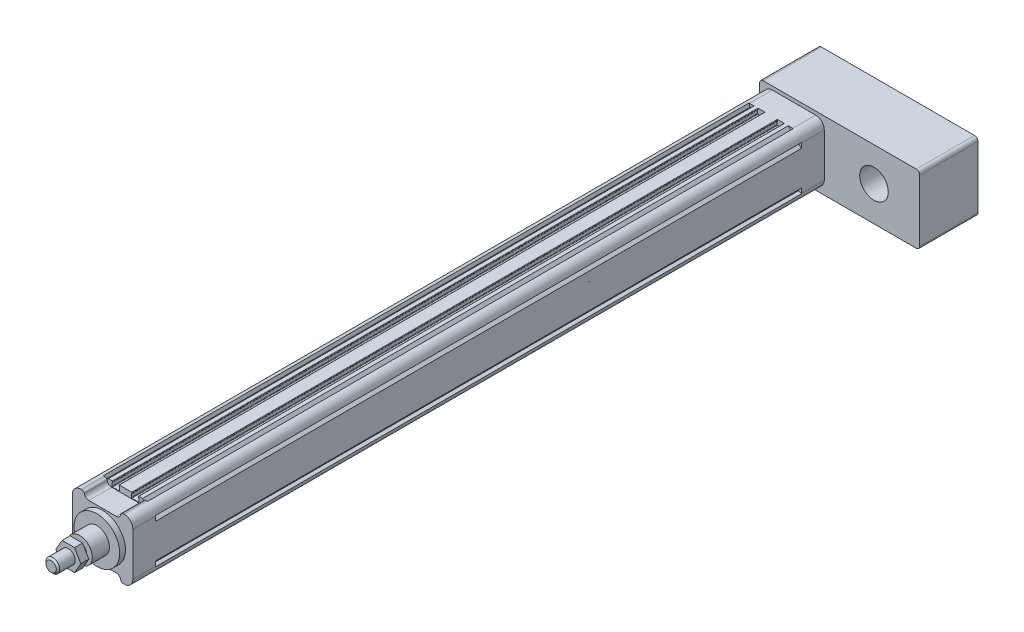
from build123d import *

# Parameters (mm, degrees)
SKETCH_1_R                  = 2.1
EXTRUDE_1_DEPTH             = 565
EXTRUDE_2_DEPTH             = 20
SKETCH_7_R                  = 20
EXTRUDE_3_DEPTH             = 5
SKETCH_9_R                  = 11
EXTRUDE_4_DEPTH             = 15
SKETCH_10_R                 = 6
EXTRUDE_5_DEPTH             = 25
EXTRUDE_START               = 20
EXTRUDE_6_DEPTH             = 20
EXTRUDE_7_DEPTH             = 51
SKETCH_13_R                 = 12.5
CUT_EXTRUDE_2_DEPTH         = 30
PATTERN_LINEAR_1_COUNT      = 2
PATTERN_LINEAR_1_PITCH      = 38
PATTERN_LINEAR_1_COUNT_DIR2 = 2
PATTERN_LINEAR_1_PITCH_DIR2 = 38
HOLE_WIZARD_M6_2_D          = 5
HOLE_WIZARD_M6_2_DEPTH      = 15
HOLE_WIZARD_M6_2_TIP        = 1.502151548
HOLE_WIZARD_M6_3_D          = 5
HOLE_WIZARD_M6_3_DEPTH      = 15
HOLE_WIZARD_M6_3_TIP        = 1.502151548
HOLE_WIZARD_M6_4_D          = 5
HOLE_WIZARD_M6_4_DEPTH      = 15
HOLE_WIZARD_M6_4_TIP        = 1.502151548
CHAMFER_1_SIZE              = 1.5
EXTRUDE_START_2             = 3
EXTRUDE_8_DEPTH             = 7


with BuildPart() as part:
    # 草图1 → 凸台-拉伸1 (new body)
    with BuildSketch(Plane.XY):
        with BuildLine():
            Line((-18.2, 24), (-19.443439638, 26.486879276))
            ThreePointArc((-19.443439638, 26.486879276), (-24.303300859, 24.303300859), (-26.486879276, 19.443439638))
            Line((-26.486879276, 19.443439638), (-24, 18.2))
            Line((-24, 18.2), (-24, 17.1))
            Line((-24, 17.1), (-26.5, 15))
            Line((-26.5, 15), (-26.5, -15))
            Line((-26.5, -15), (-24, -17.1))
            Line((-24, -17.1), (-24, -18.2))
            Line((-24, -18.2), (-26.486879276, -19.443439638))
            ThreePointArc((-26.486879276, -19.443439638), (-24.303300859, -24.303300859), (-19.443439638, -26.486879276))
            Line((-19.443439638, -26.486879276), (-18.2, -24))
            Line((-18.2, -24), (-17.1, -24))
            Line((-17.1, -24), (-15, -26.5))
            Line((-15, -26.5), (-11.65, -26.5))
            ThreePointArc((-11.65, -26.5), (-11.367157288, -26.382842712), (-11.25, -26.1))
            Line((-11.25, -26.1), (-11.25, -25.6))
            ThreePointArc((-11.25, -25.6), (-11.367157288, -25.317157288), (-11.65, -25.2))
            Line((-11.65, -25.2), (-11.75, -25.2))
            Line((-11.75, -25.2), (-11.75, -22.4))
            ThreePointArc((-11.75, -22.4), (-11.632842712, -22.117157288), (-11.35, -22))
            Line((-11.35, -22), (-5.65, -22))
            ThreePointArc((-5.65, -22), (-5.367157288, -22.117157288), (-5.25, -22.4))
            Line((-5.25, -22.4), (-5.25, -25.2))
            Line((-5.25, -25.2), (-5.35, -25.2))
            ThreePointArc((-5.35, -25.2), (-5.632842712, -25.317157288), (-5.75, -25.6))
            Line((-5.75, -25.6), (-5.75, -26.1))
            ThreePointArc((-5.75, -26.1), (-5.632842712, -26.382842712), (-5.35, -26.5))
            Line((-5.35, -26.5), (5.35, -26.5))
            ThreePointArc((5.35, -26.5), (5.632842712, -26.382842712), (5.75, -26.1))
            Line((5.75, -26.1), (5.75, -25.6))
            ThreePointArc((5.75, -25.6), (5.632842712, -25.317157288), (5.35, -25.2))
            Line((5.35, -25.2), (5.25, -25.2))
            Line((5.25, -25.2), (5.25, -22.4))
            ThreePointArc((5.25, -22.4), (5.367157288, -22.117157288), (5.65, -22))
            Line((5.65, -22), (11.35, -22))
            ThreePointArc((11.35, -22), (11.632842712, -22.117157288), (11.75, -22.4))
            Line((11.75, -22.4), (11.75, -25.2))
            Line((11.75, -25.2), (11.65, -25.2))
            ThreePointArc((11.65, -25.2), (11.367157288, -25.317157288), (11.25, -25.6))
            Line((11.25, -25.6), (11.25, -26.1))
            ThreePointArc((11.25, -26.1), (11.367157288, -26.382842712), (11.65, -26.5))
            Line((11.65, -26.5), (15, -26.5))
            Line((15, -26.5), (17.1, -24))
            Line((17.1, -24), (18.2, -24))
            Line((18.2, -24), (19.443439638, -26.486879276))
            ThreePointArc((19.443439638, -26.486879276), (24.303300859, -24.303300859), (26.486879276, -19.443439638))
            Line((26.486879276, -19.443439638), (24, -18.2))
            Line((24, -18.2), (24, -17.1))
            Line((24, -17.1), (26.5, -15))
            Line((26.5, -15), (26.5, 15))
            Line((26.5, 15), (24, 17.1))
            Line((24, 17.1), (24, 18.2))
            Line((24, 18.2), (26.486879276, 19.443439638))
            ThreePointArc((26.486879276, 19.443439638), (24.303300859, 24.303300859), (19.443439638, 26.486879276))
            Line((19.443439638, 26.486879276), (18.2, 24))
            Line((18.2, 24), (17.1, 24))
            Line((17.1, 24), (15, 26.5))
            Line((15, 26.5), (11.65, 26.5))
            ThreePointArc((11.65, 26.5), (11.367157288, 26.382842712), (11.25, 26.1))
            Line((11.25, 26.1), (11.25, 25.6))
            ThreePointArc((11.25, 25.6), (11.367157288, 25.317157288), (11.65, 25.2))
            Line((11.65, 25.2), (11.75, 25.2))
            Line((11.75, 25.2), (11.75, 22.4))
            ThreePointArc((11.75, 22.4), (11.632842712, 22.117157288), (11.35, 22))
            Line((11.35, 22), (5.65, 22))
            ThreePointArc((5.65, 22), (5.367157288, 22.117157288), (5.25, 22.4))
            Line((5.25, 22.4), (5.25, 25.2))
            Line((5.25, 25.2), (5.35, 25.2))
            ThreePointArc((5.35, 25.2), (5.632842712, 25.317157288), (5.75, 25.6))
            Line((5.75, 25.6), (5.75, 26.1))
            ThreePointArc((5.75, 26.1), (5.632842712, 26.382842712), (5.35, 26.5))
            Line((5.35, 26.5), (-5.35, 26.5))
            ThreePointArc((-5.35, 26.5), (-5.632842712, 26.382842712), (-5.75, 26.1))
            Line((-5.75, 26.1), (-5.75, 25.6))
            ThreePointArc((-5.75, 25.6), (-5.632842712, 25.317157288), (-5.35, 25.2))
            Line((-5.35, 25.2), (-5.25, 25.2))
            Line((-5.25, 25.2), (-5.25, 22.4))
            ThreePointArc((-5.25, 22.4), (-5.367157288, 22.117157288), (-5.65, 22))
            Line((-5.65, 22), (-11.35, 22))
            ThreePointArc((-11.35, 22), (-11.632842712, 22.117157288), (-11.75, 22.4))
            Line((-11.75, 22.4), (-11.75, 25.2))
            Line((-11.75, 25.2), (-11.65, 25.2))
            ThreePointArc((-11.65, 25.2), (-11.367157288, 25.317157288), (-11.25, 25.6))
            Line((-11.25, 25.6), (-11.25, 26.1))
            ThreePointArc((-11.25, 26.1), (-11.367157288, 26.382842712), (-11.65, 26.5))
            Line((-11.65, 26.5), (-15, 26.5))
            Line((-15, 26.5), (-17.1, 24))
            Line((-17.1, 24), (-18.2, 24))
        make_face()
        with Locations((19, 19)):
            Circle(SKETCH_1_R, mode=Mode.SUBTRACT)
        with Locations((19, -19)):
            Circle(SKETCH_1_R, mode=Mode.SUBTRACT)
        with Locations((-19, -19)):
            Circle(SKETCH_1_R, mode=Mode.SUBTRACT)
        with Locations((-19, 19)):
            Circle(SKETCH_1_R, mode=Mode.SUBTRACT)
        with BuildLine():
            Line((19.773719933, 3), (23.3, 3))
            Line((23.3, 3), (23.3, -3))
            Line((23.3, -3), (19.773719933, -3))
            ThreePointArc((19.773719933, -3), (0, -20), (-19.773719933, -3))
            Line((-19.773719933, -3), (-23.3, -3))
            Line((-23.3, -3), (-23.3, 3))
            Line((-23.3, 3), (-19.773719933, 3))
            ThreePointArc((-19.773719933, 3), (0, 20), (19.773719933, 3))
        make_face(mode=Mode.SUBTRACT)
    extrude(amount=EXTRUDE_1_DEPTH)

    # 草图6 → 凸台-拉伸2 (add)
    with BuildSketch(Plane.XY.offset(565)):
        with BuildLine():
            Line((-26.5, -19), (-26.5, 19))
            ThreePointArc((-26.5, 19), (-24.303300859, 24.303300859), (-19, 26.5))
            Line((-19, 26.5), (-17.916079783, 26.5))
            ThreePointArc((-17.916079783, 26.5), (-16.625085334, 26.027525232), (-15.944053189, 24.833333333))
            ThreePointArc((-15.944053189, 24.833333333), (-14.581988897, 22.444949537), (-12, 21.5))
            Line((-12, 21.5), (12, 21.5))
            ThreePointArc((12, 21.5), (14.581988897, 22.444949537), (15.944053189, 24.833333333))
            ThreePointArc((15.944053189, 24.833333333), (16.625085334, 26.027525232), (17.916079783, 26.5))
            Line((17.916079783, 26.5), (19, 26.5))
            ThreePointArc((19, 26.5), (24.303300859, 24.303300859), (26.5, 19))
            Line((26.5, 19), (26.5, -19))
            ThreePointArc((26.5, -19), (24.303300859, -24.303300859), (19, -26.5))
            Line((19, -26.5), (17.916079783, -26.5))
            ThreePointArc((17.916079783, -26.5), (16.625085334, -26.027525232), (15.944053189, -24.833333333))
            ThreePointArc((15.944053189, -24.833333333), (14.581988897, -22.444949537), (12, -21.5))
            Line((12, -21.5), (-12, -21.5))
            ThreePointArc((-12, -21.5), (-14.581988897, -22.444949537), (-15.944053189, -24.833333333))
            ThreePointArc((-15.944053189, -24.833333333), (-16.625085334, -26.027525232), (-17.916079783, -26.5))
            Line((-17.916079783, -26.5), (-19, -26.5))
            ThreePointArc((-19, -26.5), (-24.303300859, -24.303300859), (-26.5, -19))
        make_face()
    extrude(amount=EXTRUDE_2_DEPTH)

    # 草图7 → 凸台-拉伸3 (add)
    with BuildSketch(Plane.XY.offset(585)):
        Circle(SKETCH_7_R)
    extrude(amount=EXTRUDE_3_DEPTH)

    # 草图9 → 凸台-拉伸4 (add)
    with BuildSketch(Plane.XY.offset(590)):
        Circle(SKETCH_9_R)
    extrude(amount=EXTRUDE_4_DEPTH)

    # 草图10 → 凸台-拉伸5 (add)
    with BuildSketch(Plane.XY.offset(605)):
        Circle(SKETCH_10_R)
    extrude(amount=EXTRUDE_5_DEPTH)

    # 草图11 → 凸台-拉伸6 (add)
    with BuildSketch(Plane(origin=(0, 0, 0), x_dir=(-1, 0, 0), z_dir=(0, 0, -1)).offset(EXTRUDE_START)):
        with BuildLine():
            Line((-19, -26.5), (19, -26.5))
            ThreePointArc((19, -26.5), (24.303300859, -24.303300859), (26.5, -19))
            Line((26.5, -19), (26.5, 19))
            ThreePointArc((26.5, 19), (24.303300859, 24.303300859), (19, 26.5))
            Line((19, 26.5), (-19, 26.5))
            ThreePointArc((-19, 26.5), (-24.303300859, 24.303300859), (-26.5, 19))
            Line((-26.5, 19), (-26.5, -19))
            ThreePointArc((-26.5, -19), (-24.303300859, -24.303300859), (-19, -26.5))
        make_face()
    extrude(amount=-EXTRUDE_6_DEPTH)

    # 草图12 → 凸台-拉伸7 (add)
    with BuildSketch(Plane(origin=(0, 0, -20), x_dir=(-1, 0, 0), z_dir=(0, 0, -1))):
        with BuildLine():
            Line((-107, -30.404162038), (27, -30.404162038))
            ThreePointArc((27, -30.404162038), (29.121320344, -29.525482382), (30, -27.404162038))
            Line((30, -27.404162038), (30, 26.595837962))
            ThreePointArc((30, 26.595837962), (29.121320344, 28.717158305), (27, 29.595837962))
            Line((27, 29.595837962), (-107, 29.595837962))
            ThreePointArc((-107, 29.595837962), (-109.121320344, 28.717158305), (-110, 26.595837962))
            Line((-110, 26.595837962), (-110, -27.404162038))
            ThreePointArc((-110, -27.404162038), (-109.121320344, -29.525482382), (-107, -30.404162038))
        make_face()
    extrude(amount=EXTRUDE_7_DEPTH)

    # 草图13 → 切除-拉伸2 (cut)
    with BuildSketch(Plane.XY.offset(-20)):
        with Locations((70, 0)):
            Circle(SKETCH_13_R)
    extrude(amount=-CUT_EXTRUDE_2_DEPTH, mode=Mode.SUBTRACT)

    # 草图15 → M6 螺纹孔1 (revolve, cut)
    with BuildSketch(Plane(origin=(-19, -19, -71), x_dir=(0, 1, 0), z_dir=(1, 0, 0))):
        Polygon((0, 0), (0, 16.502151548), (2.5, 15), (2.5, 0), align=None)
    hole_wizard_m6_1 = revolve(axis=Axis((-19, -19, -77.35), (0, 0, 1)), mode=Mode.SUBTRACT)

    # 阵列(线性)1: Hole Wizard M6 _1 2 × 2
    with Locations(*[(j * PATTERN_LINEAR_1_PITCH_DIR2, i * PATTERN_LINEAR_1_PITCH, 0) for i in range(PATTERN_LINEAR_1_COUNT) for j in range(PATTERN_LINEAR_1_COUNT_DIR2) if (i, j) != (0, 0)]):
        add(hole_wizard_m6_1, mode=Mode.SUBTRACT)

    # M6 螺纹孔2
    with Locations(Plane(origin=(0, 0, -71), x_dir=(-1, 0, 0), z_dir=(0, 0, -1))):
        with Locations((-84, -19), (-84, 19)):
            Hole(HOLE_WIZARD_M6_2_D / 2, depth=HOLE_WIZARD_M6_2_DEPTH)
            with Locations((0, 0, -(HOLE_WIZARD_M6_2_DEPTH + HOLE_WIZARD_M6_2_TIP / 2))):  # 118° drill point
                Cone(0, HOLE_WIZARD_M6_2_D / 2, HOLE_WIZARD_M6_2_TIP, mode=Mode.SUBTRACT)

    # M6 螺纹孔3
    with Locations(Plane.ZY.offset(26.5)):
        with Locations((575, 11), (575, -11)):
            Hole(HOLE_WIZARD_M6_3_D / 2, depth=HOLE_WIZARD_M6_3_DEPTH)
            with Locations((0, 0, -(HOLE_WIZARD_M6_3_DEPTH + HOLE_WIZARD_M6_3_TIP / 2))):  # 118° drill point
                Cone(0, HOLE_WIZARD_M6_3_D / 2, HOLE_WIZARD_M6_3_TIP, mode=Mode.SUBTRACT)

    # M6 螺纹孔4
    with Locations(Plane.ZY.offset(26.5)):
        with Locations((-10, 11), (-10, -11)):
            Hole(HOLE_WIZARD_M6_4_D / 2, depth=HOLE_WIZARD_M6_4_DEPTH)
            with Locations((0, 0, -(HOLE_WIZARD_M6_4_DEPTH + HOLE_WIZARD_M6_4_TIP / 2))):  # 118° drill point
                Cone(0, HOLE_WIZARD_M6_4_D / 2, HOLE_WIZARD_M6_4_TIP, mode=Mode.SUBTRACT)

    # 倒角1
    chamfer_1_edges = [part.edges().sort_by_distance(p)[0] for p in [
        (-6, 0, 630),
    ]]
    chamfer(chamfer_1_edges, length=CHAMFER_1_SIZE)

    # 草图23 → 凸台-拉伸8 (add)
    with BuildSketch(Plane.XY.offset(605).offset(EXTRUDE_START_2)):
        Polygon((10.969655115, 0), (5.484827557, 9.5), (-5.484827557, 9.5), (-10.969655115, 0), (-5.484827557, -9.5), (5.484827557, -9.5), align=None)
    extrude(amount=EXTRUDE_8_DEPTH)


solid = part.part
